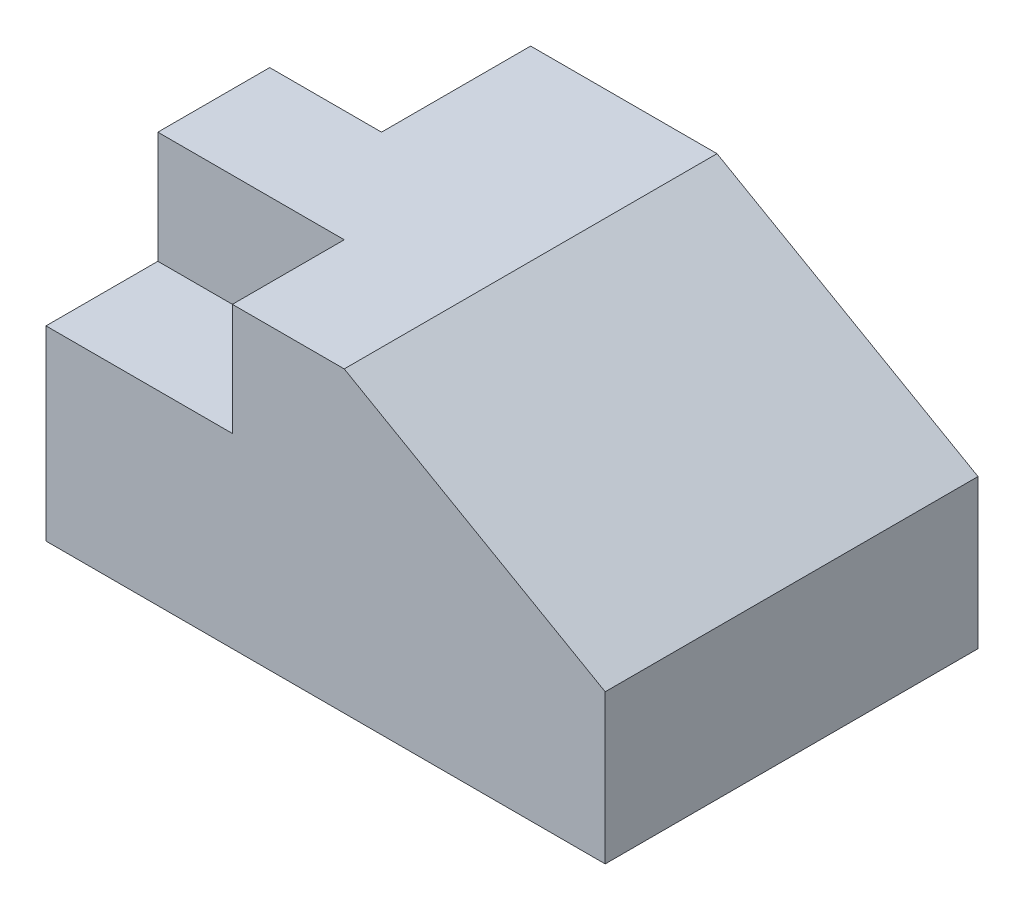
from build123d import *

# Parameters (mm, degrees)
BOSS_EXTRUDE1_DEPTH = 100
SKETCH2_W           = 50
SKETCH2_H           = 30
SKETCH2_W_2         = 30
SKETCH2_H_2         = 40
CUT_EXTRUDE1_DEPTH  = 30


with BuildPart() as part:
    # Sketch1 → Boss-Extrude1 (new body)
    with BuildSketch(Plane.XY):
        Polygon((0, 0), (150, 0), (150, 40), (80, 80), (0, 80), align=None)
    extrude(amount=-BOSS_EXTRUDE1_DEPTH)

    # Sketch2 → Cut-Extrude1 (cut)
    with BuildSketch(Plane(origin=(0, 80, 0), x_dir=(1, 0, 0), z_dir=(0, 1, 0))):
        with Locations((25, 15)):
            Rectangle(SKETCH2_W, SKETCH2_H)
        with Locations((15, 80)):
            Rectangle(SKETCH2_W_2, SKETCH2_H_2)
    extrude(amount=-CUT_EXTRUDE1_DEPTH, mode=Mode.SUBTRACT)


solid = part.part
